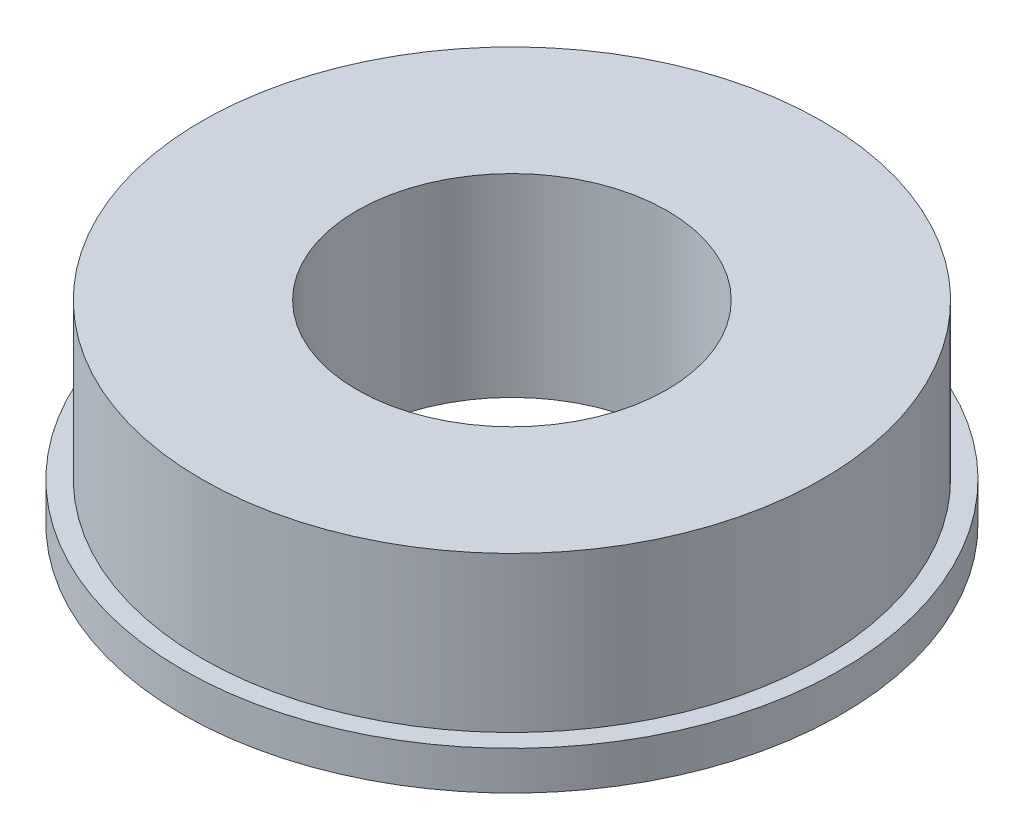
from build123d import *

# Parameters (mm, degrees)
SKETCH_1_R      = 8.5
SKETCH_1_R_2    = 4
EXTRUDE_1_DEPTH = 1
SKETCH_2_R      = 8
SKETCH_2_R_2    = 4
EXTRUDE_2_DEPTH = 4


with BuildPart() as part:
    # 草图1 → 凸台-拉伸1 (new body)
    with BuildSketch(Plane(origin=(0, 0, 0), x_dir=(1, 0, 0), z_dir=(0, 1, 0))):
        with Locations(Location((0, 0, 0), (0, 0, 270))):
            Circle(SKETCH_1_R)
        with Locations(Location((0, 0, 0), (0, 0, 270))):
            Circle(SKETCH_1_R_2, mode=Mode.SUBTRACT)
    extrude(amount=EXTRUDE_1_DEPTH)

    # 草图2 → 凸台-拉伸2 (add)
    with BuildSketch(Plane(origin=(0, 1, 0), x_dir=(1, 0, 0), z_dir=(0, 1, 0))):
        with Locations(Location((0, 0, 0), (0, 0, 270))):
            Circle(SKETCH_2_R)
        with Locations(Location((0, 0, 0), (0, 0, 270))):
            Circle(SKETCH_2_R_2, mode=Mode.SUBTRACT)
    extrude(amount=EXTRUDE_2_DEPTH)


solid = part.part
